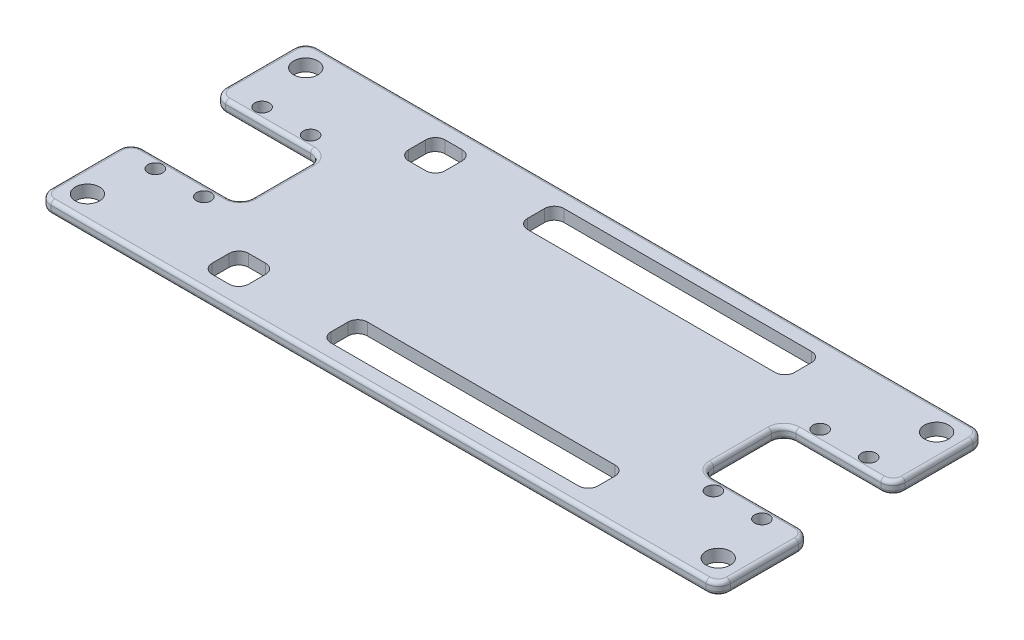
from build123d import *

# Parameters (mm, degrees)
SKETCH1_W           = 177.8
SKETCH1_H           = 69.85
BOSS_EXTRUDE1_DEPTH = 3.175
SKETCH2_R           = 3.175
SKETCH2_R_2         = 1.905
SKETCH2_W           = 28.575
SKETCH2_H           = 21.59
CUT_EXTRUDE1_DEPTH  = 96.56697259
FILLET1_R           = 3.175
FILLET2_R           = 1.000000032
SKETCH3_W           = 69.85
SKETCH3_H           = 9.525
SKETCH3_W_2         = 9.525
CUT_EXTRUDE2_DEPTH  = 96.56697259
FILLET3_R           = 2.54


with BuildPart() as part:
    # Sketch1 → Boss-Extrude1 (new body)
    with BuildSketch(Plane(origin=(0, 0, 0), x_dir=(1, 0, 0), z_dir=(0, 1, 0))):
        Rectangle(SKETCH1_W, SKETCH1_H)
    extrude(amount=BOSS_EXTRUDE1_DEPTH)

    # Sketch2 → Cut-Extrude1 (cut, through all)
    with BuildSketch(Plane(origin=(0, 3.175, 0), x_dir=(1, 0, 0), z_dir=(0, 1, 0))):
        with Locations(Location((-82.55, 28.575, 0), (0, 0, 270))):
            Circle(SKETCH2_R)
        with Locations(Location((-82.55, -28.575, 0), (0, 0, 270))):
            Circle(SKETCH2_R)
        with Locations(Location((82.55, 28.575, 0), (0, 0, 270))):
            Circle(SKETCH2_R)
        with Locations(Location((82.55, -28.575, 0), (0, 0, 270))):
            Circle(SKETCH2_R)
        with Locations(Location((-66.675, 13.97, 0), (0, 0, 270))):
            Circle(SKETCH2_R_2)
        with Locations(Location((-79.375, 13.97, 0), (0, 0, 270))):
            Circle(SKETCH2_R_2)
        with Locations(Location((-66.675, -13.97, 0), (0, 0, 270))):
            Circle(SKETCH2_R_2)
        with Locations(Location((-79.375, -13.97, 0), (0, 0, 270))):
            Circle(SKETCH2_R_2)
        with Locations(Location((66.675, 13.97, 0), (0, 0, 270))):
            Circle(SKETCH2_R_2)
        with Locations(Location((79.375, 13.97, 0), (0, 0, 270))):
            Circle(SKETCH2_R_2)
        with Locations(Location((66.675, -13.97, 0), (0, 0, 270))):
            Circle(SKETCH2_R_2)
        with Locations(Location((79.375, -13.97, 0), (0, 0, 270))):
            Circle(SKETCH2_R_2)
        with Locations((-74.6125, 0)):
            Rectangle(SKETCH2_W, SKETCH2_H)
        with Locations((74.6125, 0)):
            Rectangle(SKETCH2_W, SKETCH2_H)
    extrude(amount=-CUT_EXTRUDE1_DEPTH, mode=Mode.SUBTRACT)

    # Fillet1
    fillet1_edges = [part.edges().sort_by_distance(p)[0] for p in [
        (-88.9, 1.5875, 10.795),
        (-88.9, 1.5875, -10.795),
        (-60.325, 1.5875, -10.795),
        (-60.325, 1.5875, 10.795),
        (88.9, 1.5875, -10.795),
        (88.9, 1.5875, 10.795),
        (60.325, 1.5875, 10.795),
        (60.325, 1.5875, -10.795),
        (88.9, 1.5875, 34.925),
        (-88.9, 1.5875, 34.925),
        (-88.9, 1.5875, -34.925),
        (88.9, 1.5875, -34.925),
    ]]
    fillet(fillet1_edges, radius=FILLET1_R)

    # Fillet2
    fillet2_edges = [part.edges().sort_by_distance(p)[0] for p in [
        (-88.9, 0, -22.86),
        (88.9, 0, -22.86),
        (74.6125, 0, -10.795),
        (60.325, 0, 0),
        (-87.97006403, 0, -11.72493597),
        (-87.97006403, 0, 11.72493597),
        (87.97006403, 0, -11.72493597),
        (87.97006403, 0, 11.72493597),
        (-87.97006403, 0, 33.99506403),
        (-87.97006403, 0, -33.99506403),
        (87.97006403, 0, 33.99506403),
        (87.97006403, 0, -33.99506403),
        (88.9, 3.175, -22.86),
        (88.9, 3.175, 22.86),
        (74.6125, 3.175, 10.795),
        (60.325, 3.175, 0),
        (74.6125, 3.175, -10.795),
        (-88.9, 3.175, -22.86),
        (-74.6125, 3.175, -10.795),
        (-60.325, 3.175, 0),
        (-74.6125, 3.175, 10.795),
        (-88.9, 3.175, 22.86),
        (0, 3.175, 34.925),
        (-87.97006403, 3.175, -11.72493597),
        (-87.97006403, 3.175, 11.72493597),
        (87.97006403, 3.175, -11.72493597),
        (87.97006403, 3.175, 11.72493597),
        (-87.97006403, 3.175, 33.99506403),
        (-87.97006403, 3.175, -33.99506403),
        (87.97006403, 3.175, 33.99506403),
        (87.97006403, 3.175, -33.99506403),
        (61.25493597, 3.175, 9.86506403),
        (61.25493597, 0, 9.86506403),
        (61.25493597, 3.175, -9.86506403),
        (61.25493597, 0, -9.86506403),
        (-61.25493597, 3.175, 9.86506403),
        (-61.25493597, 0, 9.86506403),
        (-61.25493597, 3.175, -9.86506403),
        (-61.25493597, 0, -9.86506403),
        (0, 0, -34.925),
        (0, 3.175, -34.925),
        (74.6125, 0, 10.795),
        (88.9, 0, 22.86),
        (0, 0, 34.925),
        (-88.9, 0, 22.86),
        (-74.6125, 0, 10.795),
        (-60.325, 0, 0),
        (-74.6125, 0, -10.795),
    ]]
    fillet(fillet2_edges, radius=FILLET2_R)

    # Sketch3 → Cut-Extrude2 (cut, through all)
    with BuildSketch(Plane(origin=(0, 3.175, 0), x_dir=(1, 0, 0), z_dir=(0, 1, 0))):
        with Locations((15.509999968, 25.7175)):
            Rectangle(SKETCH3_W, SKETCH3_H)
        with Locations((15.509999968, -25.7175)):
            Rectangle(SKETCH3_W, SKETCH3_H)
        with Locations((-45.767500032, 25.7175)):
            Rectangle(SKETCH3_W_2, SKETCH3_H)
        with Locations((-45.767500032, -25.7175)):
            Rectangle(SKETCH3_W_2, SKETCH3_H)
    extrude(amount=-CUT_EXTRUDE2_DEPTH, mode=Mode.SUBTRACT)

    # Fillet3
    fillet3_edges = [part.edges().sort_by_distance(p)[0] for p in [
        (-19.415000032, 1.5875, -20.955),
        (-19.415000032, 1.5875, -30.48),
        (50.434999968, 1.5875, -30.48),
        (50.434999968, 1.5875, -20.955),
        (50.434999968, 1.5875, 20.955),
        (50.434999968, 1.5875, 30.48),
        (-19.415000032, 1.5875, 30.48),
        (-19.415000032, 1.5875, 20.955),
        (-50.530000032, 1.5875, -20.955),
        (-50.530000032, 1.5875, -30.48),
        (-41.005000032, 1.5875, -30.48),
        (-41.005000032, 1.5875, -20.955),
        (-50.530000032, 1.5875, 30.48),
        (-50.530000032, 1.5875, 20.955),
        (-41.005000032, 1.5875, 20.955),
        (-41.005000032, 1.5875, 30.48),
    ]]
    fillet(fillet3_edges, radius=FILLET3_R)


solid = part.part
